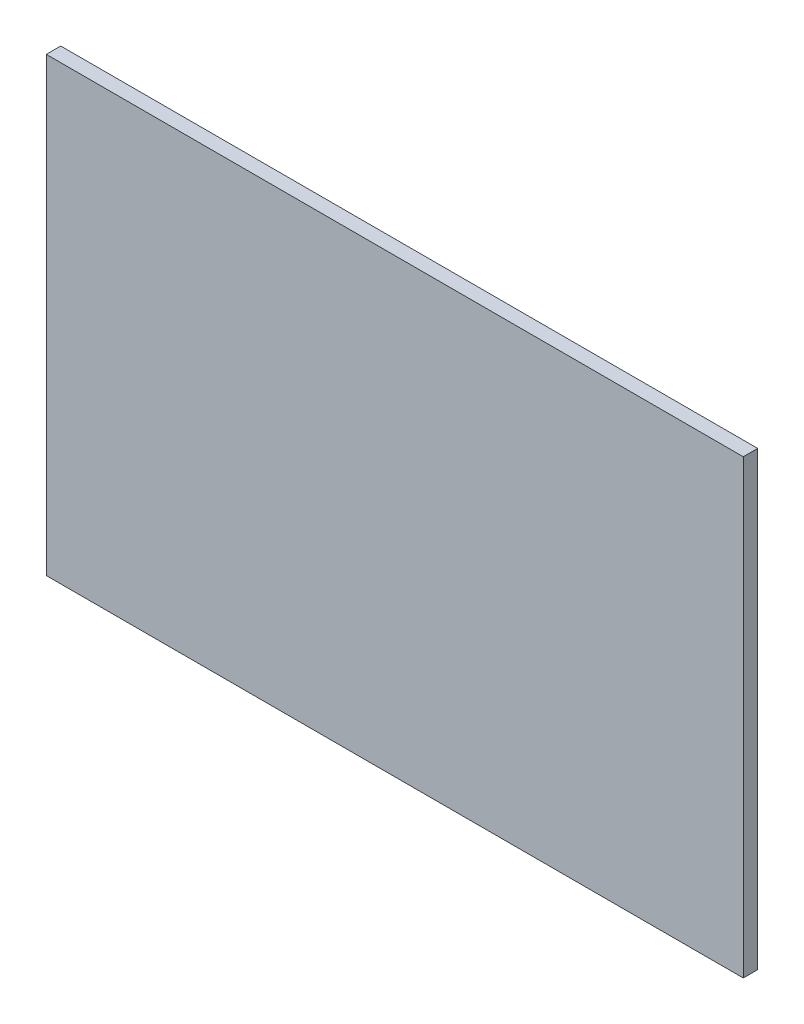
from build123d import *

# Parameters (mm, degrees)
SKETCH1_W           = 3860
SKETCH1_H           = 2500
BOSS_EXTRUDE1_DEPTH = 80


with BuildPart() as part:
    # Sketch1 → Boss-Extrude1 (new body)
    with BuildSketch(Plane.XY):
        with Locations((1930, 1250)):
            Rectangle(SKETCH1_W, SKETCH1_H)
    extrude(amount=BOSS_EXTRUDE1_DEPTH)


solid = part.part
